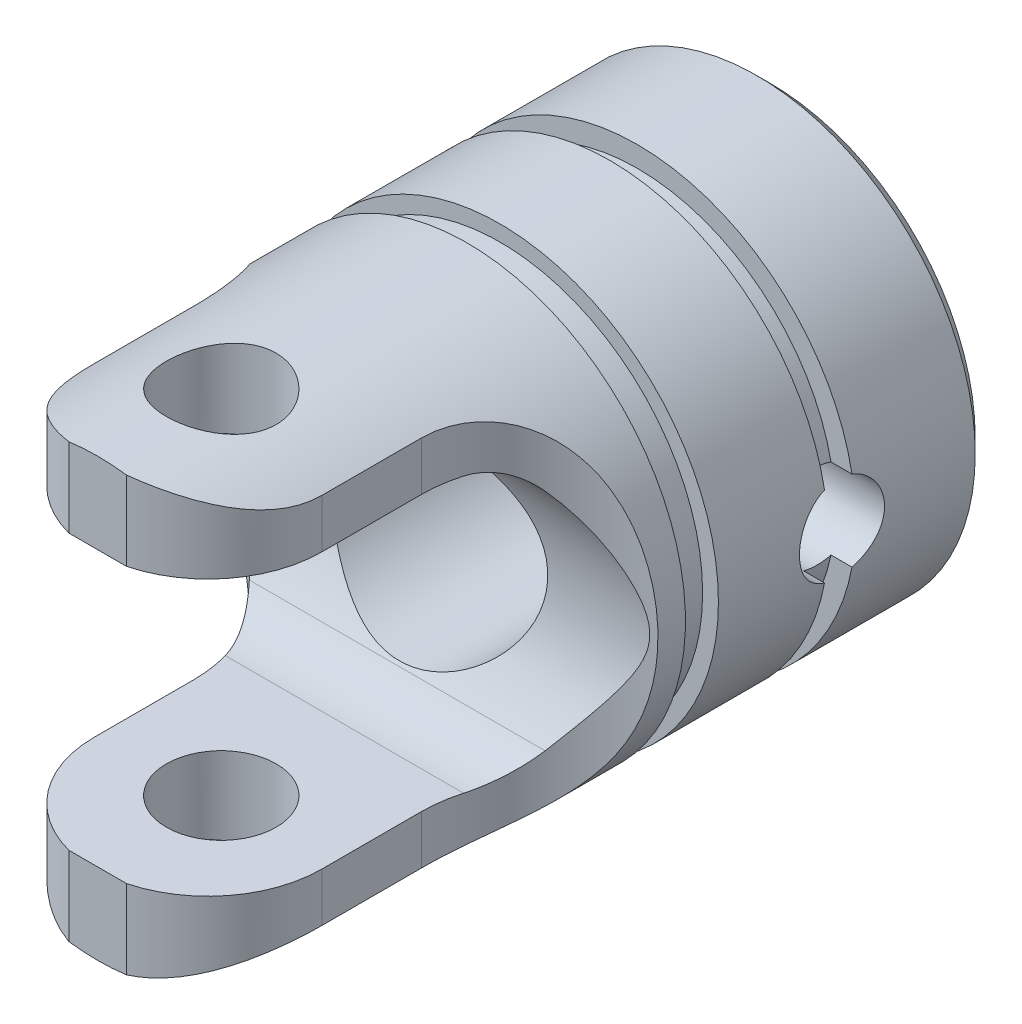
from build123d import *

# Parameters (mm, degrees)
SKETCH1_R               = 15.9
BOSS_EXTRUDE1_DEPTH     = 49
SKETCH2_R               = 8
CUT_EXTRUDE1_DEPTH      = 49
CUT_EXTRUDE2_DEPTH      = 54.913078191
CUT_EXTRUDE2_DEPTH_BACK = 54.913078191
SKETCH3_R               = 3.1
SKETCH6_W               = 3
SKETCH6_H               = 2
SKETCH7_W               = 2.3
SKETCH7_H               = 2.4
CUT_EXTRUDE3_DEPTH      = 54.913078341
CUT_EXTRUDE3_DEPTH_BACK = 54.913078341
CUT_EXTRUDE4_DEPTH      = 54.913078341
CUT_EXTRUDE4_DEPTH_BACK = 54.913078341
CHAMFER1_SIZE           = 1
CUT_EXTRUDE5_DEPTH      = 58.659518019
CUT_EXTRUDE5_DEPTH_BACK = 58.659518019
SKETCH10_R              = 4
FILLET2_R               = 5


with BuildPart() as part:
    # Sketch1 → Boss-Extrude1 (new body)
    with BuildSketch(Plane.XY):
        Circle(SKETCH1_R)
    extrude(amount=BOSS_EXTRUDE1_DEPTH)

    # Sketch2 → Cut-Extrude1 (cut)
    with BuildSketch(Plane.XY):
        Circle(SKETCH2_R)
    extrude(amount=CUT_EXTRUDE1_DEPTH, mode=Mode.SUBTRACT)

    # Sketch3 → Cut-Extrude2 (cut, two sides: drawn at the far end of the back side and taken through both)
    with BuildSketch(Plane(origin=(0, 0, 0), x_dir=(0, 0, -1), z_dir=(1, 0, 0)).offset(-CUT_EXTRUDE2_DEPTH_BACK)):
        with Locations((-10.7, 0)):
            Circle(SKETCH3_R)
    extrude(amount=CUT_EXTRUDE2_DEPTH + CUT_EXTRUDE2_DEPTH_BACK, mode=Mode.SUBTRACT)

    # Sketch6 → Cut-Revolve2 (revolve, cut)
    with BuildSketch(Plane(origin=(0, 0, 0), x_dir=(1, 0, 0), z_dir=(0, 1, 0)), mode=Mode.PRIVATE) as cut_revolve2_sk:
        with Locations((15.9, -10.7)):
            Rectangle(SKETCH6_W, SKETCH6_H)
    revolve(cut_revolve2_sk.sketch.rotate(Axis((0, 0, 49), (0, 0, -1)), 190.634633322), axis=Axis((0, 0, 49), (0, 0, -1)), mode=Mode.SUBTRACT)

    # Sketch7 → Cut-Revolve3 (revolve, cut)
    with BuildSketch(Plane(origin=(0, 0, 0), x_dir=(1, 0, 0), z_dir=(0, 1, 0)), mode=Mode.PRIVATE) as cut_revolve3_sk:
        with Locations((15.9, -20.9)):
            Rectangle(SKETCH7_W, SKETCH7_H)
    revolve(cut_revolve3_sk.sketch.rotate(Axis((0, 0, 0), (0, 0, 1)), 180), axis=Axis((0, 0, 0), (0, 0, 1)), mode=Mode.SUBTRACT)

    # Sketch8 → Cut-Extrude3 (cut, two sides: drawn at the far end of the back side and taken through both)
    with BuildSketch(Plane(origin=(0, 0, 0), x_dir=(1, 0, 0), z_dir=(0, 1, 0)).offset(-CUT_EXTRUDE3_DEPTH_BACK)):
        with BuildLine():
            Line((15.9, -24.1), (15.9, -43.362187412))
            Line((15.9, -43.362187412), (15.9, -50.372696334))
            Line((15.9, -50.372696334), (-15.9, -50.372696334))
            Line((-15.9, -50.372696334), (-15.9, -24.1))
            ThreePointArc((-15.9, -24.1), (-10.428826144, -27.596805525), (-8.3, -33.731093706))
            Line((-8.3, -33.731093706), (-8.3, -40.97005604))
            ThreePointArc((-8.3, -40.97005604), (0, -49.27005604), (8.3, -40.97005604))
            Line((8.3, -40.97005604), (8.3, -33.731093706))
            ThreePointArc((8.3, -33.731093706), (10.428826144, -27.596805525), (15.9, -24.1))
        make_face()
    extrude(amount=CUT_EXTRUDE3_DEPTH + CUT_EXTRUDE3_DEPTH_BACK, mode=Mode.SUBTRACT)

    # Sketch9 → Cut-Extrude4 (cut, two sides: drawn at the far end of the back side and taken through both)
    with BuildSketch(Plane(origin=(0, 0, 0), x_dir=(0, 0, -1), z_dir=(1, 0, 0)).offset(-CUT_EXTRUDE4_DEPTH_BACK)):
        with BuildLine():
            Line((-49.025089954, -10), (-29.025089954, -10))
            ThreePointArc((-29.025089954, -10), (-24.22526277, 0.007636151), (-29.056803626, 10))
            Line((-29.056803626, 10), (-49.056803626, 10))
            Line((-49.056803626, 10), (-49.025089954, -10))
        make_face()
    extrude(amount=CUT_EXTRUDE4_DEPTH + CUT_EXTRUDE4_DEPTH_BACK, mode=Mode.SUBTRACT)

    # Chamfer1
    chamfer1_edges = [part.edges().sort_by_distance(p)[0] for p in [
        (-15.9, 0, 0),
        (-8, 0, 0),
    ]]
    chamfer(chamfer1_edges, length=CHAMFER1_SIZE)

    # Sketch10 → Cut-Extrude5 (cut, two sides: drawn at the far end of the back side and taken through both)
    with BuildSketch(Plane(origin=(0, -10, 0), x_dir=(1, 0, 0), z_dir=(0, 1, 0)).offset(-CUT_EXTRUDE5_DEPTH_BACK)):
        with Locations(Location((0, -40, 0), (0, 0, 270))):
            Circle(SKETCH10_R)
    extrude(amount=CUT_EXTRUDE5_DEPTH + CUT_EXTRUDE5_DEPTH_BACK, mode=Mode.SUBTRACT)

    # Fillet2
    fillet2_edges = [part.edges().sort_by_distance(p)[0] for p in [
        (0, -10, 29.025089954),
        (0, 10, 29.056803626),
    ]]
    fillet(fillet2_edges, radius=FILLET2_R)


solid = part.part
